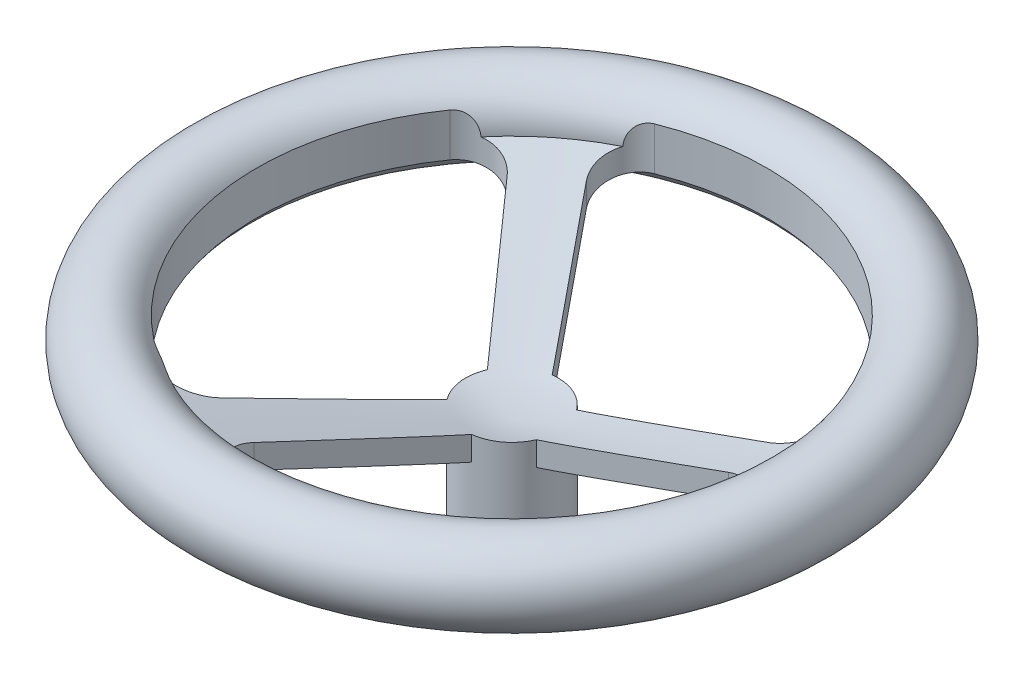
from build123d import *

# Parameters (mm, degrees)
CUT_EXTRUDE1_DEPTH = 218.993055499


with BuildPart() as part:
    # Sketch1 → Revolve1 (revolve)
    with BuildSketch(Plane.XY, mode=Mode.PRIVATE) as revolve1_sk:
        with BuildLine():
            Line((20, -100.740243091), (20, -69.715325618))
            Line((20, -69.715325618), (110.198752068, -44.459675039))
            ThreePointArc((110.198752068, -44.459675039), (141.851870345, -30.404499927), (107.502452813, -34.830034842))
            Line((107.502452813, -34.830034842), (0, -64.930721629))
            Line((0, -64.930721629), (0, -78.058110007))
            Line((0, -78.058110007), (12.5, -78.058110007))
            Line((12.5, -78.058110007), (12.5, -100.740243091))
            Line((12.5, -100.740243091), (20, -100.740243091))
        make_face()
    revolve(revolve1_sk.sketch.rotate(Axis((0, 122.203800038, 0), (0, -1, 0)), 180), axis=Axis((0, 122.203800038, 0), (0, -1, 0)))

    # Sketch3 → Cut-Extrude1 (cut, through all)
    with BuildSketch(Plane.XZ.offset(100.740243091)):
        with BuildLine():
            Line((-15.982116295, 12.023807996), (-45.159681095, 80.612688819))
            ThreePointArc((-45.159681095, 80.612688819), (-55.246837021, 89.273395117), (-68.253125072, 86.51748884))
            ThreePointArc((-68.253125072, 86.51748884), (-109.03897279, 15.945763394), (-90.169598509, -63.349889203))
            ThreePointArc((-90.169598509, -63.349889203), (-78.581603296, -69.711168161), (-66.461068877, -64.43479171))
            Line((-66.461068877, -64.43479171), (-18.403981322, -7.82901472))
            ThreePointArc((-18.403981322, -7.82901472), (-19.852822716, 2.421865027), (-15.982116295, 12.023807996))
        make_face()
        with BuildLine():
            Line((15.982116295, -12.023807996), (89.970611905, -21.04973607))
            ThreePointArc((89.970611905, -21.04973607), (101.087630383, -28.341543009), (102.04423972, -41.602140538))
            ThreePointArc((102.04423972, -41.602140538), (43.137382604, -101.40478874), (-40.799780672, -102.36768462))
            ThreePointArc((-40.799780672, -102.36768462), (-49.689609543, -92.481861898), (-47.232795837, -79.415775465))
            Line((-47.232795837, -79.415775465), (-2.421865027, -19.852822716))
            ThreePointArc((-2.421865027, -19.852822716), (7.82901472, -18.403981322), (15.982116295, -12.023807996))
        make_face()
        with BuildLine():
            Line((2.421865027, 19.852822716), (-21.185241198, 90.169588344))
            ThreePointArc((-21.185241198, 90.169588344), (-19.455713432, 103.249492349), (-8.062704922, 109.903401888))
            ThreePointArc((-8.062704922, 109.903401888), (69.001859108, 85.921524643), (109.052905743, 15.85019578))
            ThreePointArc((109.052905743, 15.85019578), (104.936446564, 3.208466781), (92.392476932, -1.196913354))
            Line((92.392476932, -1.196913354), (18.403981322, 7.82901472))
            ThreePointArc((18.403981322, 7.82901472), (12.023807996, 15.982116295), (2.421865027, 19.852822716))
        make_face()
    extrude(amount=-CUT_EXTRUDE1_DEPTH, mode=Mode.SUBTRACT)


solid = part.part
